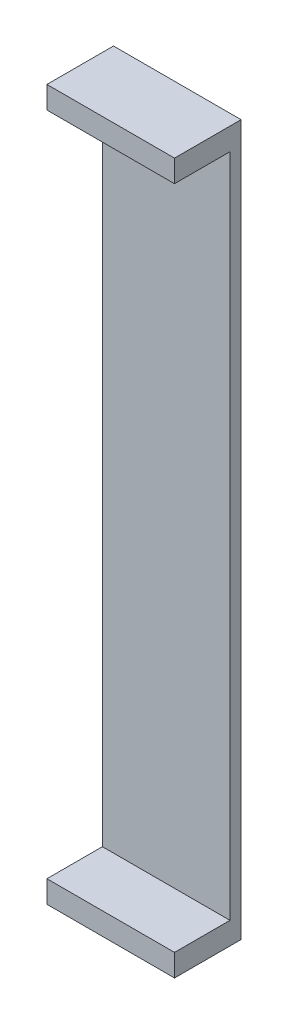
from build123d import *

# Parameters (mm, degrees)
SKETCH1_W           = 23
SKETCH1_H           = 128
BOSS_EXTRUDE1_DEPTH = 2
SKETCH2_W           = 23
SKETCH2_H           = 4
BOSS_EXTRUDE2_DEPTH = 10


with BuildPart() as part:
    # Sketch1 → Boss-Extrude1 (new body)
    with BuildSketch(Plane(origin=(0, 7.022278801, 0), x_dir=(1, 0, 0), z_dir=(0, 0, 1))):
        with Locations((12.125906736, 57.738860104)):
            Rectangle(SKETCH1_W, SKETCH1_H)
    extrude(amount=BOSS_EXTRUDE1_DEPTH)

    # Sketch2 → Boss-Extrude2 (add)
    with BuildSketch(Plane(origin=(0, 7.022278801, 2), x_dir=(1, 0, 0), z_dir=(0, 0, 1))):
        with Locations((12.125906736, 119.738860104)):
            Rectangle(SKETCH2_W, SKETCH2_H)
        with Locations((12.125906736, -4.261139896)):
            Rectangle(SKETCH2_W, SKETCH2_H)
    extrude(amount=BOSS_EXTRUDE2_DEPTH)


solid = part.part
